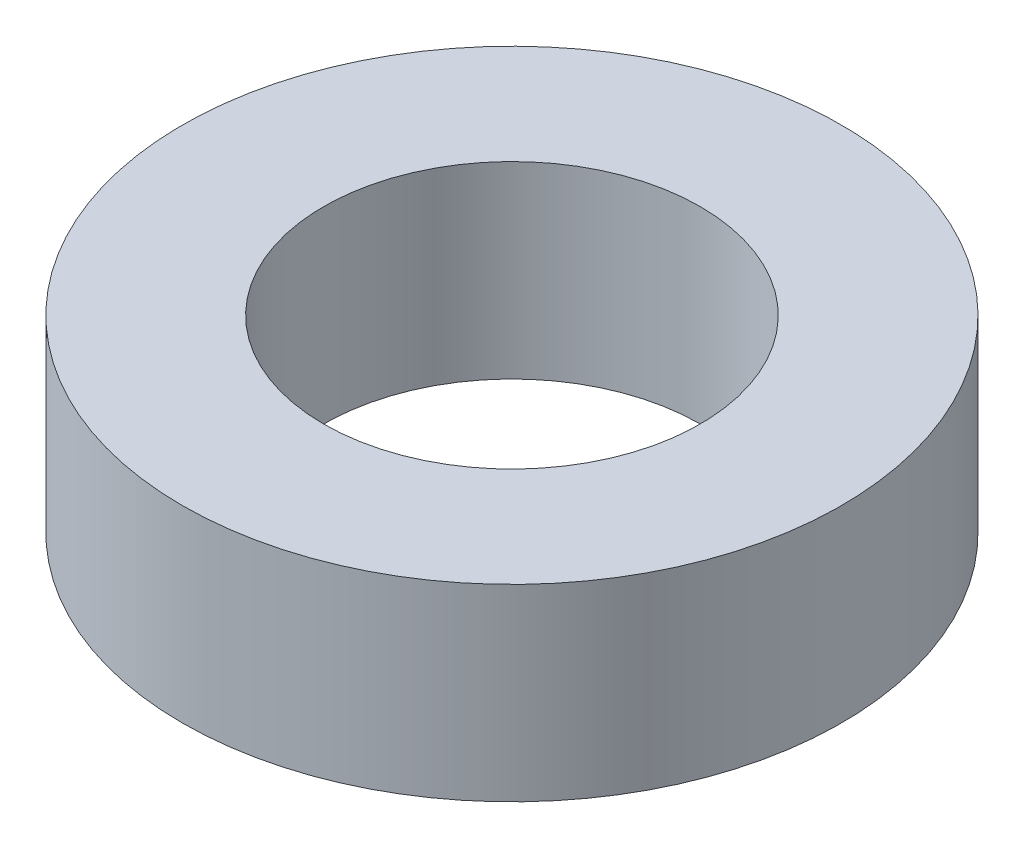
from build123d import *

# Parameters (mm, degrees)
SKETCH_1_R      = 7
SKETCH_1_R_2    = 4
EXTRUDE_1_DEPTH = 4


with BuildPart() as part:
    # 草图1 → 凸台-拉伸1 (new body)
    with BuildSketch(Plane(origin=(0, 0, 0), x_dir=(1, 0, 0), z_dir=(0, 1, 0))):
        with Locations(Location((0, 0, 0), (0, 0, 270))):
            Circle(SKETCH_1_R)
        with Locations(Location((0, 0, 0), (0, 0, 270))):
            Circle(SKETCH_1_R_2, mode=Mode.SUBTRACT)
    extrude(amount=EXTRUDE_1_DEPTH)


solid = part.part
